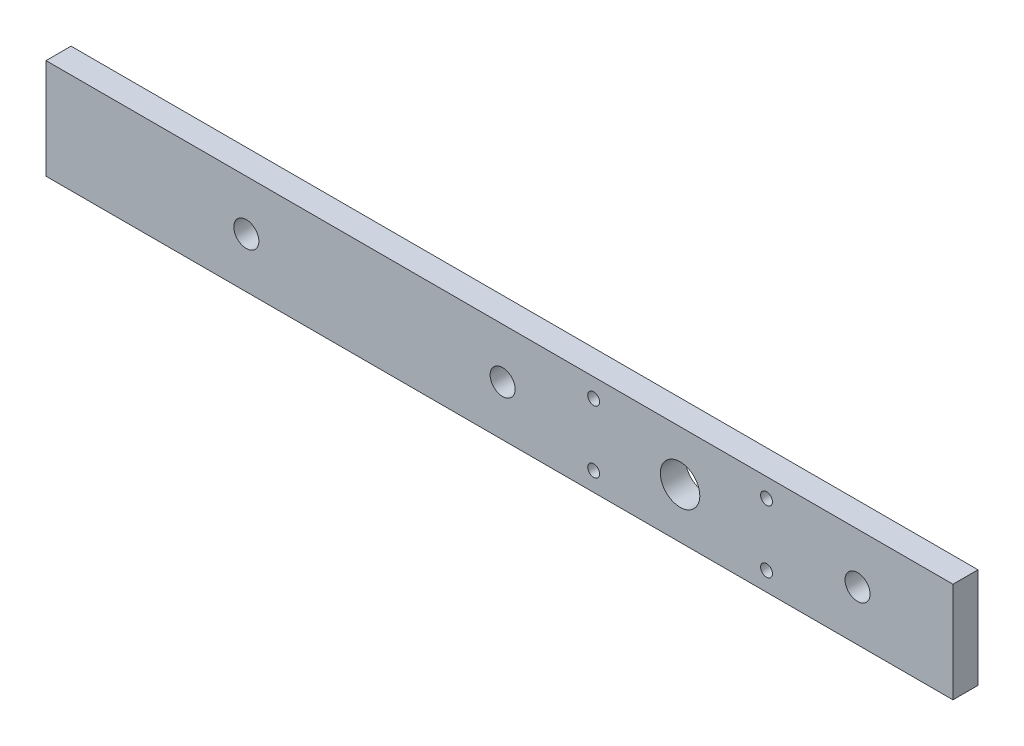
from build123d import *

# Parameters (mm, degrees)
SKETCH1_W           = 6.35
SKETCH1_H           = 25.4
BOSS_EXTRUDE1_DEPTH = 304.8
SKETCH2_R           = 5
SKETCH2_R_2         = 3.175
CUT_EXTRUDE1_DEPTH  = 306.922412549
SKETCH4_R           = 1.5
CUT_EXTRUDE2_DEPTH  = 306.922412549
SKETCH5_R           = 3.175
CUT_EXTRUDE3_DEPTH  = 306.922412549
SKETCH6_W           = 74.8
SKETCH6_H           = 25.4
CUT_EXTRUDE5_DEPTH  = 10


with BuildPart() as part:
    # Sketch1 → Boss-Extrude1 (new body)
    with BuildSketch(Plane(origin=(0, 0, 0), x_dir=(0, 0, -1), z_dir=(1, 0, 0))):
        with Locations((3.175, 12.7)):
            Rectangle(SKETCH1_W, SKETCH1_H)
    extrude(amount=BOSS_EXTRUDE1_DEPTH)

    # Sketch2 → Cut-Extrude1 (cut, through all)
    with BuildSketch(Plane.XY):
        with Locations((160.8, 12.7)):
            Circle(SKETCH2_R)
        with Locations((50.8, 12.7)):
            Circle(SKETCH2_R_2)
        with Locations((115.8, 12.7)):
            Circle(SKETCH2_R_2)
        with Locations((205.8, 12.7)):
            Circle(SKETCH2_R_2)
    extrude(amount=-CUT_EXTRUDE1_DEPTH, mode=Mode.SUBTRACT)

    # Sketch4 → Cut-Extrude2 (cut, through all)
    with BuildSketch(Plane.XY):
        with Locations((138.879689783, 20.6)):
            Circle(SKETCH4_R)
        with Locations((182.720310217, 20.6)):
            Circle(SKETCH4_R)
        with Locations((182.720310217, 4.8)):
            Circle(SKETCH4_R)
        with Locations((138.879689783, 4.8)):
            Circle(SKETCH4_R)
    extrude(amount=-CUT_EXTRUDE2_DEPTH, mode=Mode.SUBTRACT)

    # Sketch5 → Cut-Extrude3 (cut, through all)
    with BuildSketch(Plane.XY):
        with Locations((241.3, 12.7)):
            Circle(SKETCH5_R)
        with Locations((292.1, 12.7)):
            Circle(SKETCH5_R)
    extrude(amount=-CUT_EXTRUDE3_DEPTH, mode=Mode.SUBTRACT)

    # Sketch6 → Cut-Extrude5 (cut)
    with BuildSketch(Plane.XY):
        with Locations((267.4, 12.7)):
            Rectangle(SKETCH6_W, SKETCH6_H)
    extrude(amount=-CUT_EXTRUDE5_DEPTH, mode=Mode.SUBTRACT)


solid = part.part
